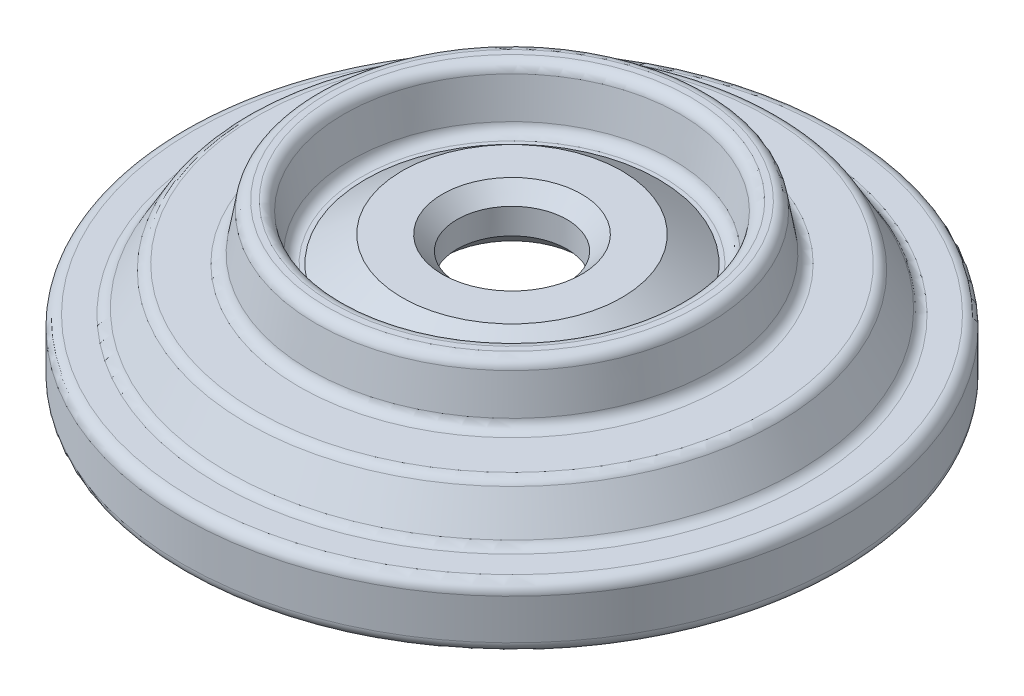
from build123d import *

# Parameters (mm, degrees)
CHAMFER_2_SIZE = 4


with BuildPart() as part:
    # 草图1 → 旋转1 (revolve)
    with BuildSketch(Plane.XY, mode=Mode.PRIVATE) as revolve_1_sk:
        with BuildLine():
            Line((-15, 15), (-15, 0))
            Line((-15, 0), (-66.881197846, 0))
            Line((-66.881197846, 0), (-79.005553499, -21))
            Line((-79.005553499, -21), (-87, -21))
            ThreePointArc((-87, -21), (-89.121320344, -20.121320344), (-90, -18))
            Line((-90, -18), (-90, -7))
            ThreePointArc((-90, -7), (-89.121320344, -4.878679656), (-87, -4))
            Line((-87, -4), (-80.160254038, -4))
            ThreePointArc((-80.160254038, -4), (-78.660254038, -3.598076211), (-77.562177826, -2.5))
            Line((-77.562177826, -2.5), (-72.366025404, 6.5))
            ThreePointArc((-72.366025404, 6.5), (-71.267949192, 7.598076211), (-69.767949192, 8))
            Line((-69.767949192, 8), (-58.162203604, 8))
            ThreePointArc((-58.162203604, 8), (-56.233840775, 8.701866671), (-55.207780345, 10.479055467))
            Line((-55.207780345, 10.479055467), (-53.437124366, 20.520944533))
            ThreePointArc((-53.437124366, 20.520944533), (-52.411063936, 22.298133329), (-50.482701106, 23))
            Line((-50.482701106, 23), (-48.807108315, 23))
            ThreePointArc((-48.807108315, 23), (-46.878745486, 22.298133329), (-45.852685056, 20.520944533))
            Line((-45.852685056, 20.520944533), (-44.082029076, 10.479055467))
            ThreePointArc((-44.082029076, 10.479055467), (-43.055968646, 8.701866671), (-41.127605817, 8))
            Line((-41.127605817, 8), (-39.997036047, 8))
            Line((-39.997036047, 8), (-30, 15))
            Line((-30, 15), (-15, 15))
        make_face()
    revolve(revolve_1_sk.sketch.rotate(Axis((0, 85.703125, 0), (0, -1, 0)), 270), axis=Axis((0, 85.703125, 0), (0, -1, 0)))

    # 倒角2
    chamfer_2_edges = [part.edges().sort_by_distance(p)[0] for p in [
        (0, 0, -15),
        (0, 15, -15),
    ]]
    chamfer(chamfer_2_edges, length=CHAMFER_2_SIZE)


solid = part.part
